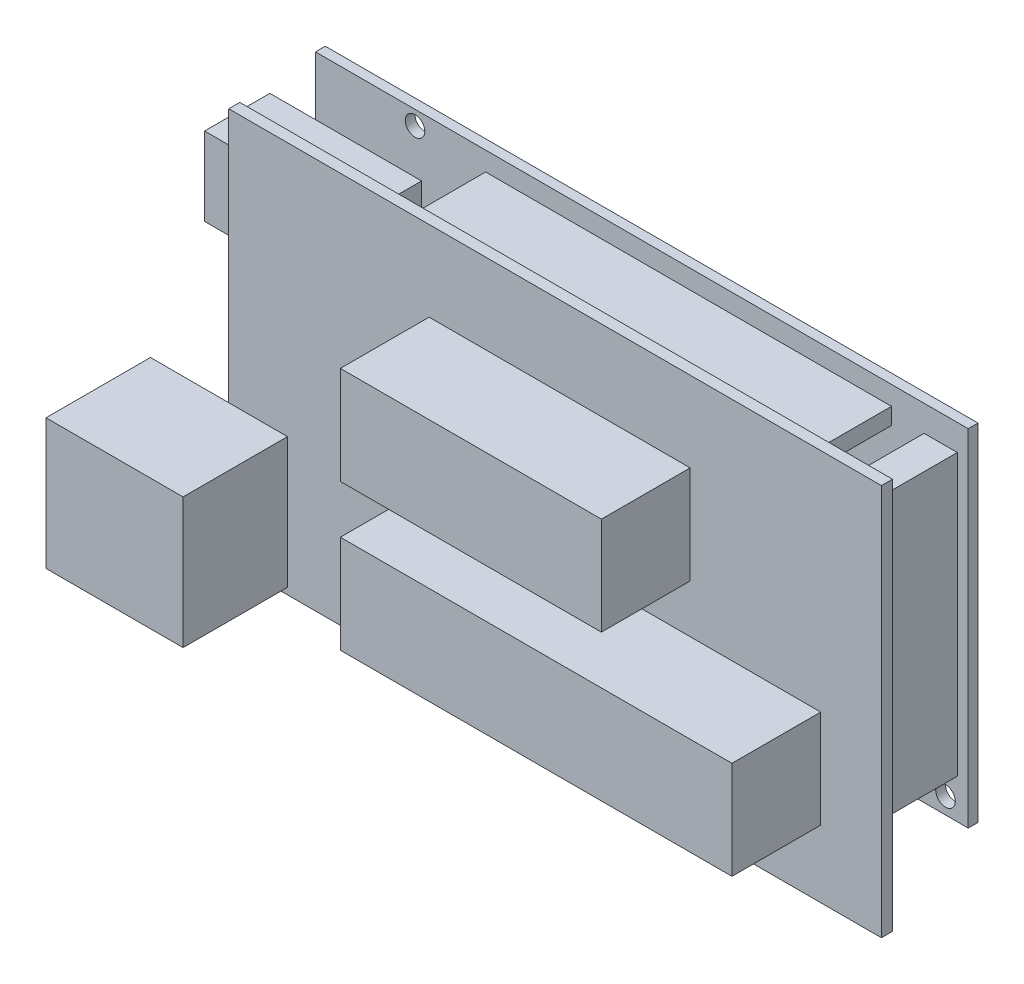
from build123d import *

# Parameters (mm, degrees)
ESBO_O1_W                 = 100
ESBO_O1_H                 = 60
RESSALTO_EXTRUS_O1_DEPTH  = 1.7
ESBO_O2_W                 = 60
ESBO_O2_H                 = 15
ESBO_O2_W_2               = 40
RESSALTO_EXTRUS_O2_DEPTH  = 13.6
RESSALTO_EXTRUS_O6_START  = 11.6
ESBO_O3_W                 = 100
ESBO_O3_H                 = 53
RESSALTO_EXTRUS_O6_DEPTH  = 1.5
ESBO_O4_W                 = 62.184169383
ESBO_O4_H                 = 2.54
ESBO_O4_W_2               = 5.08
ESBO_O4_H_2               = 42.957805244
ESBO_O4_W_3               = 56.07185462
RESSALTO_EXTRUS_O8_DEPTH  = 11.6
ESBO_O6_W                 = 21
ESBO_O6_H                 = 20
RESSALTO_EXTRUS_O9_DEPTH  = 16
ESBO_O7_W                 = 23.246964405
ESBO_O7_H                 = 12
RESSALTO_EXTRUS_O10_DEPTH = 10
ESBO_O8_R                 = 1.5
CORTE_EXTRUS_O1_DEPTH     = 10


with BuildPart() as part:
    # Esboço1 → Ressalto-extrusão1 (new body)
    with BuildSketch(Plane.XY):
        Rectangle(ESBO_O1_W, ESBO_O1_H)
    extrude(amount=RESSALTO_EXTRUS_O1_DEPTH)

    # Esboço2 → Ressalto-extrusão2 (add)
    with BuildSketch(Plane.XY.offset(1.7)):
        with Locations((10.7, -12.2)):
            Rectangle(ESBO_O2_W, ESBO_O2_H)
        with Locations((0.7, 10.2)):
            Rectangle(ESBO_O2_W_2, ESBO_O2_H)
    extrude(amount=RESSALTO_EXTRUS_O2_DEPTH)



with BuildPart() as body_2:
    # Esboço3 → Ressalto-extrusão6 (new body)
    with BuildSketch(Plane(origin=(0, 0, 0), x_dir=(-1, 0, 0), z_dir=(0, 0, -1)).offset(RESSALTO_EXTRUS_O6_START)):
        with Locations((0, 4.4)):
            Rectangle(ESBO_O3_W, ESBO_O3_H)
    extrude(amount=RESSALTO_EXTRUS_O6_DEPTH)


with BuildPart() as part_1:
    add(part.part)

    add(body_2.part)  # Ressalto-extrusão8 merges body 2
    # Esboço4 → Ressalto-extrusão8 (add)
    with BuildSketch(Plane.XY.offset(-11.6)):
        with Locations((7.150543675, 26.719832293)):
            Rectangle(ESBO_O4_W, ESBO_O4_H)
        with Locations((45.784919315, 5.42627648)):
            Rectangle(ESBO_O4_W_2, ESBO_O4_H_2)
        with Locations((10.206701056, -18.689881399)):
            Rectangle(ESBO_O4_W_3, ESBO_O4_H)
    extrude(amount=RESSALTO_EXTRUS_O8_DEPTH)

    # Esboço6 → Ressalto-extrusão9 (add)
    with BuildSketch(Plane.XY.offset(1.7)):
        with Locations((-51.5, -19)):
            Rectangle(ESBO_O6_W, ESBO_O6_H)
    extrude(amount=RESSALTO_EXTRUS_O9_DEPTH)

    # Esboço7 → Ressalto-extrusão10 (add)
    with BuildSketch(Plane.XY.offset(-11.6)):
        with Locations((-45.376517798, 15.9)):
            Rectangle(ESBO_O7_W, ESBO_O7_H)
    extrude(amount=RESSALTO_EXTRUS_O10_DEPTH)

    # Esboço8 → Corte-extrusão1 (cut)
    with BuildSketch(Plane(origin=(0, 0, -13.1), x_dir=(-1, 0, 0), z_dir=(0, 0, -1))):
        with Locations((34.76, 28.7)):
            Circle(ESBO_O8_R)
        with Locations((36.03, -19.56)):
            Circle(ESBO_O8_R)
        with Locations((-46.52, -19.56)):
            Circle(ESBO_O8_R)
    extrude(amount=-CORTE_EXTRUS_O1_DEPTH, mode=Mode.SUBTRACT)


solid = part_1.part
